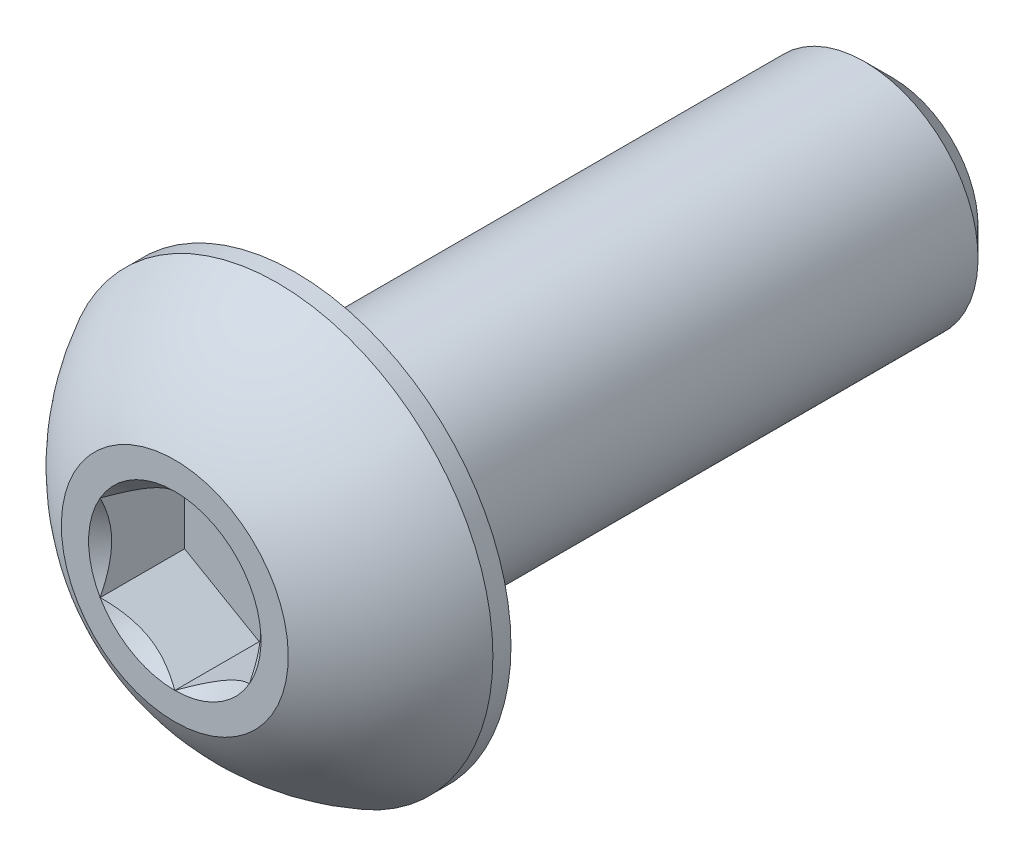
from build123d import *

# Parameters (mm, degrees)
SKETCH1_W          = 12.7
SKETCH1_H          = 2.413
CHAMFER1_SIZE      = 0.5953125
CUT_EXTRUDE2_DEPTH = 1.79578
SKETCH6_R          = 1.833087105
CUT_EXTRUDE3_DEPTH = 1.79578
CUT_EXTRUDE3_TAPER = 45


with BuildPart() as part:
    # Sketch1 → Revolve1 (revolve)
    with BuildSketch(Plane(origin=(0, 0, 0), x_dir=(0, 0, -1), z_dir=(1, 0, 0))):
        with Locations((8.9154, 1.2065)):
            Rectangle(SKETCH1_W, SKETCH1_H)
    revolve(axis=Axis((0, 0, -15.2654), (0, 0, 1)))

    # Chamfer1
    chamfer1_edges = [part.edges().sort_by_distance(p)[0] for p in [
        (0, -2.413, -15.2654),
    ]]
    chamfer(chamfer1_edges, length=CHAMFER1_SIZE)

    # Sketch7 → Revolve2 (revolve)
    with BuildSketch(Plane(origin=(0, 0, 0), x_dir=(0, 0, -1), z_dir=(1, 0, 0)), mode=Mode.PRIVATE) as revolve2_sk:
        with BuildLine():
            Line((2.18059, 4.5847), (2.5654, 4.5847))
            Line((2.5654, 4.5847), (2.5654, 0))
            Line((2.5654, 0), (0, 0))
            Line((0, 0), (0, 2.413))
            ThreePointArc((0, 2.413), (0.925030326, 3.664791196), (2.18059, 4.5847))
        make_face()
    revolve(revolve2_sk.sketch.rotate(Axis((0, 0, 0), (0, 0, -1)), 180), axis=Axis((0, 0, 0), (0, 0, -1)))

    # Sketch5 → Cut-Extrude2 (cut)
    with BuildSketch(Plane.XY):
        Polygon((1.5875, -0.916543552), (1.5875, 0.916543552), (0, 1.833087105), (-1.5875, 0.916543552), (-1.5875, -0.916543552), (0, -1.833087105), align=None)
    extrude(amount=-CUT_EXTRUDE2_DEPTH, mode=Mode.SUBTRACT)

    # Sketch6 → Cut-Extrude3 (cut)
    with BuildSketch(Plane.XY):
        Circle(SKETCH6_R)
    extrude(amount=-CUT_EXTRUDE3_DEPTH, taper=CUT_EXTRUDE3_TAPER, mode=Mode.SUBTRACT)


solid = part.part
